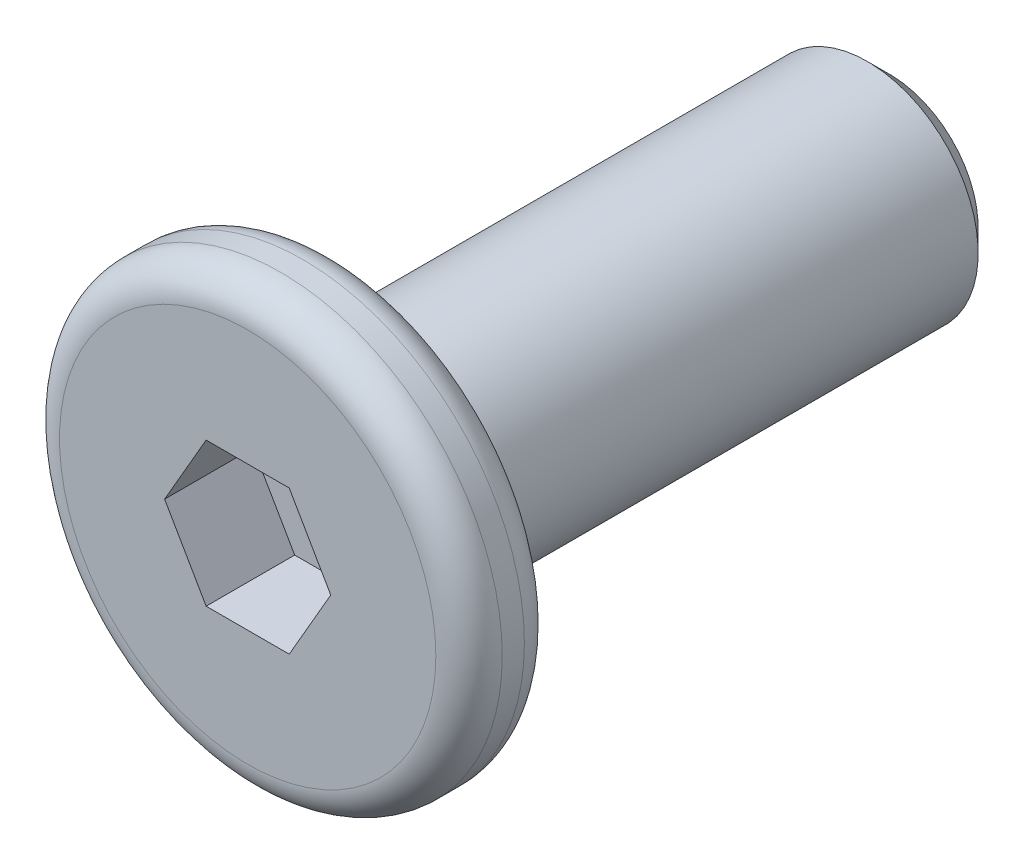
from build123d import *

# Parameters (mm, degrees)
SKETCH_1_R          = 2
EXTRUDE_1_DEPTH     = 0.4
SKETCH_2_R          = 1
EXTRUDE_2_DEPTH     = 5
CHAMFER_1_SIZE      = 0.2
CUT_EXTRUDE_1_DEPTH = 0.8
FILLET_2_R          = 0.3


with BuildPart() as part:
    # 草图1 → 凸台-拉伸1 (new, symmetric)
    with BuildSketch(Plane.XY):
        Circle(SKETCH_1_R)
    extrude(amount=EXTRUDE_1_DEPTH, both=True)

    # 草图2 → 凸台-拉伸2 (add)
    with BuildSketch(Plane(origin=(0, 0, -0.4), x_dir=(-1, 0, 0), z_dir=(0, 0, -1))):
        Circle(SKETCH_2_R)
    extrude(amount=EXTRUDE_2_DEPTH)

    # 倒角1
    chamfer_1_edges = [part.edges().sort_by_distance(p)[0] for p in [
        (1, 0, -5.4),
    ]]
    chamfer(chamfer_1_edges, length=CHAMFER_1_SIZE)

    # 草图3 → 切除-拉伸1 (cut)
    with BuildSketch(Plane.XY.offset(0.4)):
        Polygon((0.75055535, 0), (0.375277675, 0.65), (-0.375277675, 0.65), (-0.75055535, 0), (-0.375277675, -0.65), (0.375277675, -0.65), align=None)
    extrude(amount=-CUT_EXTRUDE_1_DEPTH, mode=Mode.SUBTRACT)

    # 圆角2
    fillet_2_edges = [part.edges().sort_by_distance(p)[0] for p in [
        (-2, 0, -0.4),
        (-2, 0, 0.4),
    ]]
    fillet(fillet_2_edges, radius=FILLET_2_R)


solid = part.part
